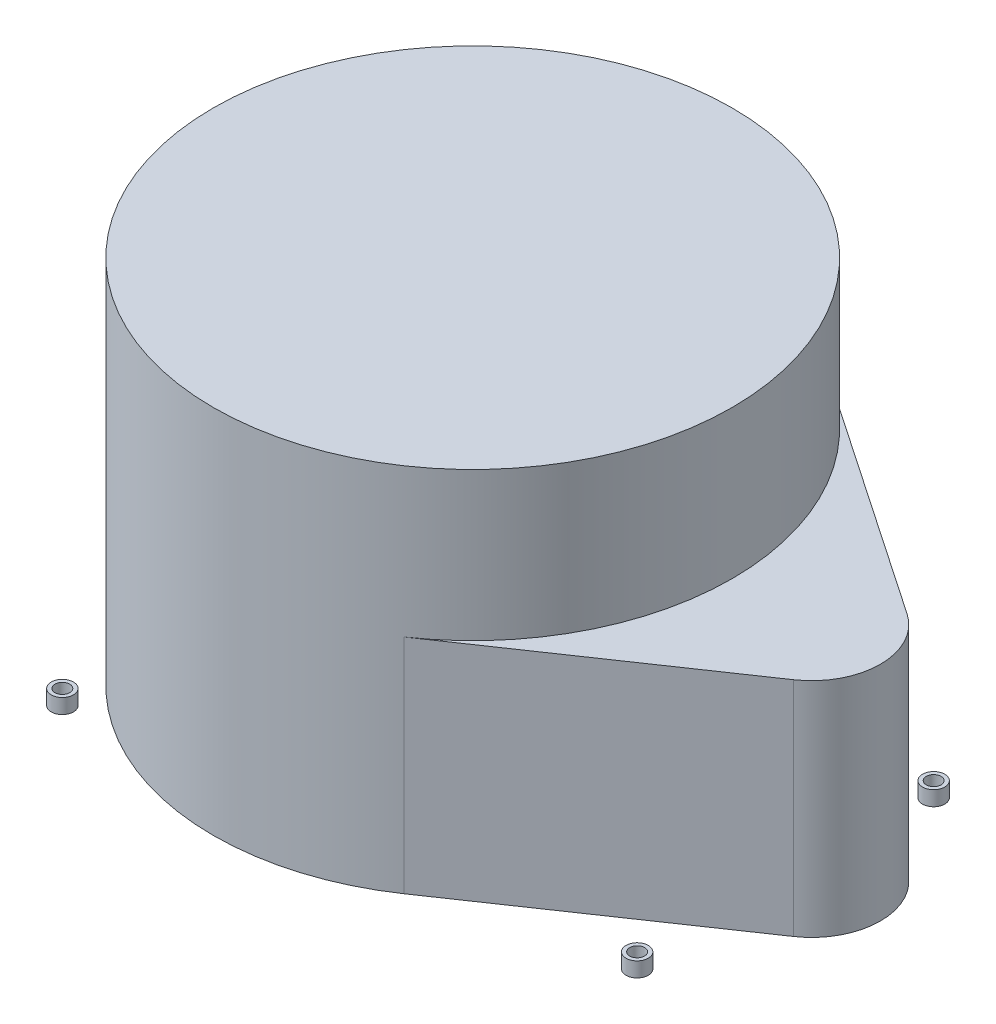
from build123d import *
from build123d.topology import SkipClean

# Parameters (mm, degrees)
EXTRUDE_START     = 5
EXTRUDE_1_DEPTH   = 30
SKETCH_2_R        = 35
EXTRUDE_2_DEPTH   = 20
SKETCH_3_R        = 1.5
SKETCH_3_R_2      = 1
EXTRUDE_3_DEPTH   = 2
EXTRUDE_3_2_DEPTH = 2
EXTRUDE_3_3_DEPTH = 2
EXTRUDE_3_4_DEPTH = 2


with BuildPart() as part:
    # 草图1 → 凸台-拉伸1 (new body)
    with BuildSketch(Plane(origin=(0, 0, 0), x_dir=(1, 0, 0), z_dir=(0, 1, 0)).offset(EXTRUDE_START)):
        with BuildLine():
            Line((19.693574926, 28.933771041), (50.947046313, 7.661307814))
            ThreePointArc((50.947046313, 7.661307814), (55, 0), (50.947046313, -7.661307814))
            Line((50.947046313, -7.661307814), (19.693574926, -28.933771041))
            ThreePointArc((19.693574926, -28.933771041), (-35, 0), (19.693574926, 28.933771041))
        make_face()
    extrude(amount=EXTRUDE_1_DEPTH)

    # 草图2 → 凸台-拉伸2 (add)
    with SkipClean():  # the faces are left unmerged after this step: merging them gives an invalid solid
        with BuildSketch(Plane(origin=(0, 35, 0), x_dir=(1, 0, 0), z_dir=(0, 1, 0))):
            with Locations(Location((0, 0, 0), (0, 0, 55.759104726))):
                Circle(SKETCH_2_R)
        extrude(amount=EXTRUDE_2_DEPTH)


with BuildPart() as body_2:
    # 草图3 → 凸台-拉伸3 (new body)
    with BuildSketch(Plane.XZ.offset(-5)):
        with Locations(Location((42.183153241, 20, 0), (0, 0, 270))):
            Circle(SKETCH_3_R)
        with Locations(Location((42.183153241, 20, 0), (0, 0, 270))):
            Circle(SKETCH_3_R_2, mode=Mode.SUBTRACT)
    extrude(amount=EXTRUDE_3_DEPTH)


with BuildPart() as body_3:
    # 草图3 → Extrude 3 2 (new body)
    with BuildSketch(Plane.XZ.offset(-5)):
        with Locations(Location((-27.358201361, 28, 0), (0, 0, 270))):
            Circle(SKETCH_3_R)
        with Locations(Location((-27.358201361, 28, 0), (0, 0, 270))):
            Circle(SKETCH_3_R_2, mode=Mode.SUBTRACT)
    extrude(amount=EXTRUDE_3_2_DEPTH)


with BuildPart() as body_4:
    # 草图3 → Extrude 3 3 (new body)
    with BuildSketch(Plane.XZ.offset(-5)):
        with Locations(Location((42.183153241, -20, 0), (0, 0, 90))):
            Circle(SKETCH_3_R)
        with Locations(Location((42.183153241, -20, 0), (0, 0, 90))):
            Circle(SKETCH_3_R_2, mode=Mode.SUBTRACT)
    extrude(amount=EXTRUDE_3_3_DEPTH)


with BuildPart() as body_5:
    # 草图3 → Extrude 3 4 (new body)
    with BuildSketch(Plane.XZ.offset(-5)):
        with Locations(Location((-27.358201361, -28, 0), (0, 0, 270))):
            Circle(SKETCH_3_R)
        with Locations(Location((-27.358201361, -28, 0), (0, 0, 90))):
            Circle(SKETCH_3_R_2, mode=Mode.SUBTRACT)
    extrude(amount=EXTRUDE_3_4_DEPTH)


solid = Compound([part.part, body_2.part, body_3.part, body_4.part, body_5.part])
